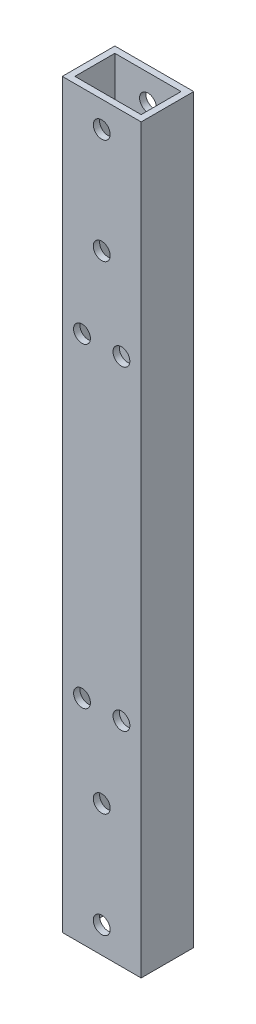
from build123d import *

# Parameters (mm, degrees)
SKETCH_1_W          = 15
SKETCH_1_H          = 10
SKETCH_1_W_2        = 12.6
SKETCH_1_H_2        = 7.6
EXTRUDE_1_DEPTH     = 70.5
SKETCH_2_R          = 1.6
CUT_EXTRUDE_1_DEPTH = 100


with BuildPart() as part:
    # ｽｹｯﾁ1 → ﾎﾞｽ - 押し出し1 (new, symmetric)
    with BuildSketch(Plane(origin=(0, 0, 0), x_dir=(1, 0, 0), z_dir=(0, 1, 0))):
        Rectangle(SKETCH_1_W, SKETCH_1_H)
        Rectangle(SKETCH_1_W_2, SKETCH_1_H_2, mode=Mode.SUBTRACT)
    extrude(amount=EXTRUDE_1_DEPTH, both=True)

    # ｽｹｯﾁ2 → ｶｯﾄ - 押し出し1 (cut)
    with BuildSketch(Plane(origin=(0, 0, -5), x_dir=(-1, 0, 0), z_dir=(0, 0, -1))):
        with Locations((0, -65.5)):
            Circle(SKETCH_2_R)
        with Locations((0, -45.5)):
            Circle(SKETCH_2_R)
        with Locations(Location((0, 45.5, 0), (0, 0, 180))):
            Circle(SKETCH_2_R)
        with Locations(Location((0, 65.5, 0), (0, 0, 180))):
            Circle(SKETCH_2_R)
        with Locations((3.75, -30)):
            Circle(SKETCH_2_R)
        with Locations(Location((-3.75, -30, 0), (0, 0, 180))):
            Circle(SKETCH_2_R)
        with Locations((-3.75, 30)):
            Circle(SKETCH_2_R)
        with Locations(Location((3.75, 30, 0), (0, 0, 180))):
            Circle(SKETCH_2_R)
    extrude(amount=-CUT_EXTRUDE_1_DEPTH, mode=Mode.SUBTRACT)


solid = part.part
